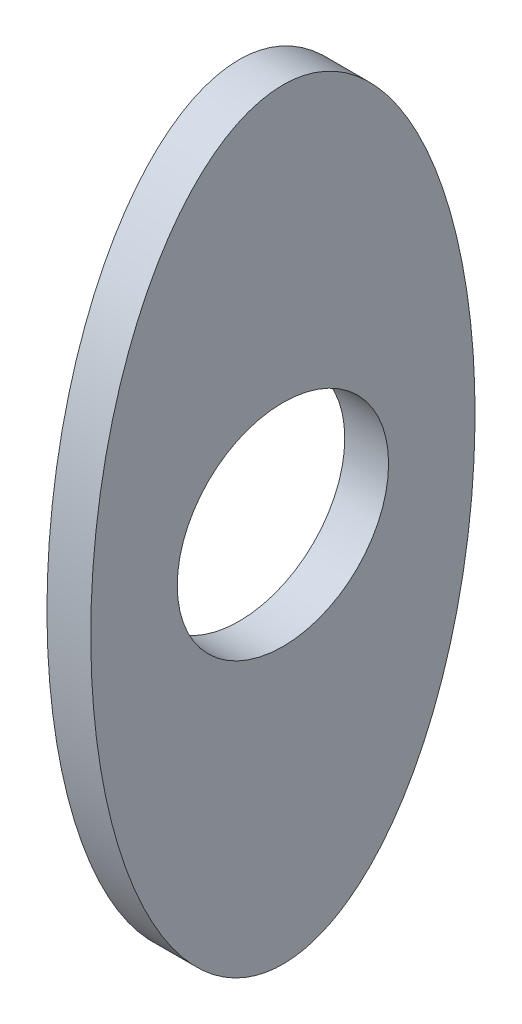
from build123d import *

# Parameters (mm, degrees)
CROQUIS2_RX             = 26.074270712
CROQUIS2_RY             = 13.157789795
SALIENTE_EXTRUIR1_DEPTH = 3
CROQUIS3_R              = 7.236106057
CORTAR_EXTRUIR1_DEPTH   = 3
ESCALA1_SCALE           = 0.7
ESCALA2_SCALE           = 1.2


with BuildPart() as part:
    # Croquis2 → Saliente-Extruir1 (new body)
    with BuildSketch(Plane(origin=(0, 0, 0), x_dir=(0, 0, -1), z_dir=(1, 0, 0))):
        with Locations(Location((0, 0), (0, 0, 90))):
            Ellipse(CROQUIS2_RX, CROQUIS2_RY)
    extrude(amount=SALIENTE_EXTRUIR1_DEPTH)

    # Croquis3 → Cortar-Extruir1 (cut)
    with BuildSketch(Plane(origin=(3, 0, 0), x_dir=(0, 0, -1), z_dir=(1, 0, 0))):
        Circle(CROQUIS3_R)
    extrude(amount=-CORTAR_EXTRUIR1_DEPTH, mode=Mode.SUBTRACT)


with BuildPart() as part_1:
    # Escala1: scaled about (1.5, 0, 0)
    add(part.part.scale(ESCALA1_SCALE).moved(Location((0.45, 0, 0))))


with BuildPart() as part_2:
    # Escala2: scaled about (1.5, 0, 0)
    add(part_1.part.scale(ESCALA2_SCALE).moved(Location((-0.3, 0, 0))))


solid = part_2.part
